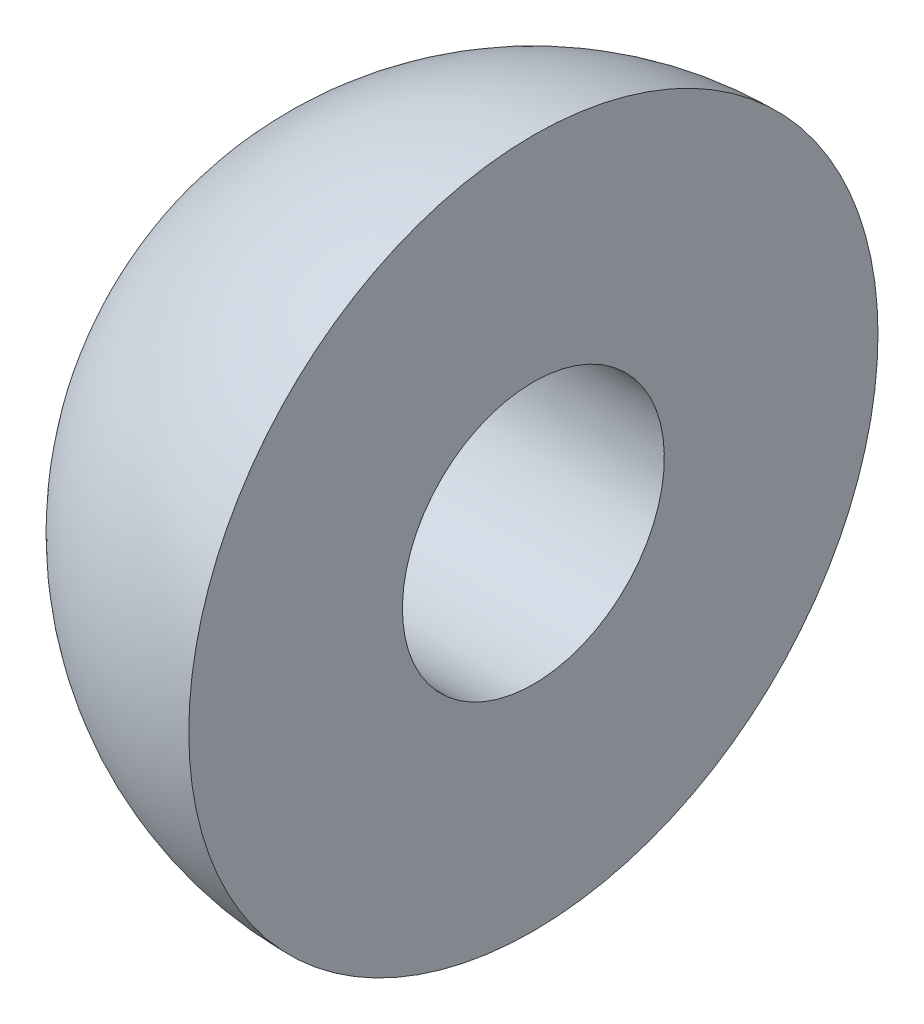
from build123d import *

# Parameters (mm, degrees)
REVOLVE_1_ANGLE     = 180
SKETCH_2_R          = 0.95
CUT_EXTRUDE_1_DEPTH = 5.330127019


with BuildPart() as part:
    # 草图1 → 旋转1 (revolve)
    with BuildSketch(Plane(origin=(0, 0, 0), x_dir=(0, 0, -1), z_dir=(1, 0, 0))):
        with BuildLine():
            Line((-2.5, 0), (2.5, 0))
            ThreePointArc((2.5, 0), (0, -2.5), (-2.5, 0))
        make_face()
    revolve(axis=Axis((0, 0, 2.5), (0, 0, -1)), revolution_arc=REVOLVE_1_ANGLE)

    # 草图2 → 切除-拉伸1 (cut, through all)
    with BuildSketch(Plane(origin=(0, 0, 0), x_dir=(0, 0, -1), z_dir=(1, 0, 0))):
        with Locations(Location((0, 0, 0), (0, 0, 90))):
            Circle(SKETCH_2_R)
    extrude(amount=-CUT_EXTRUDE_1_DEPTH, mode=Mode.SUBTRACT)


solid = part.part
